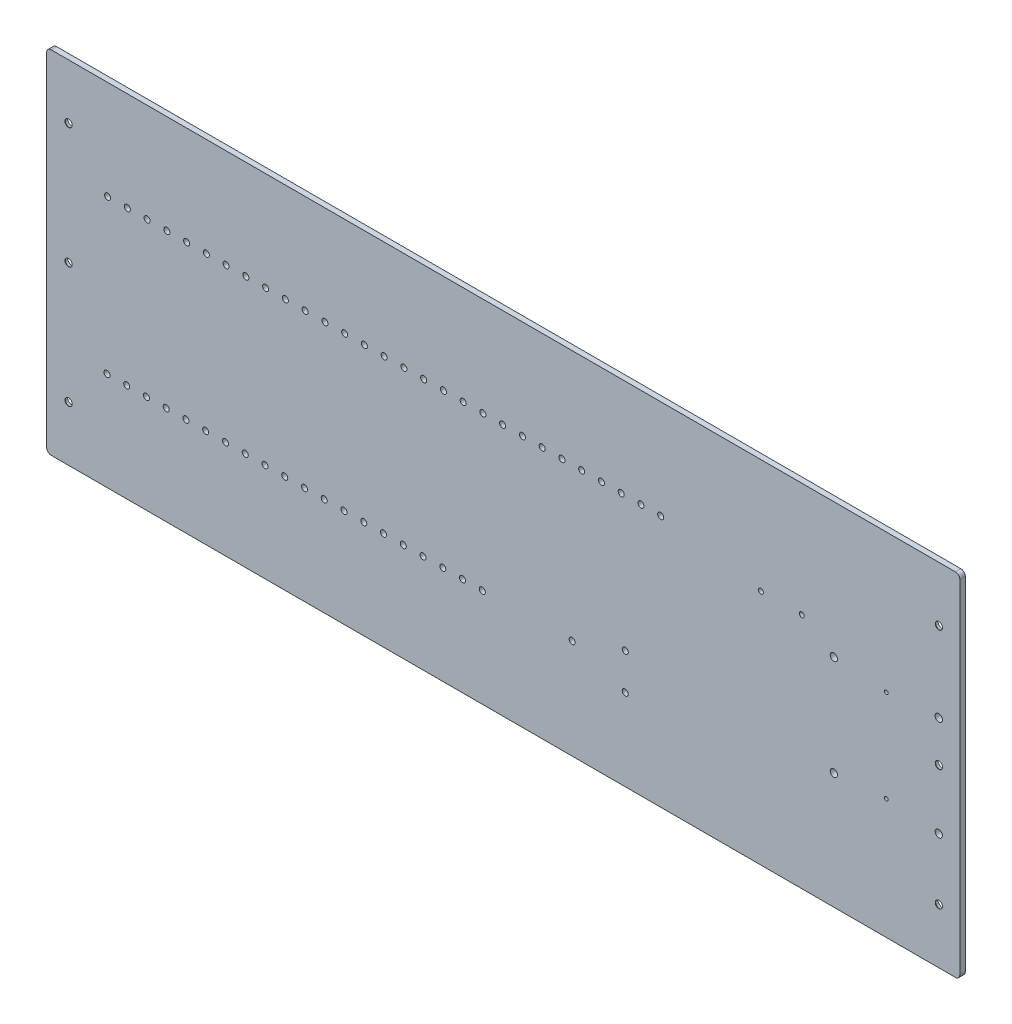
from build123d import *

# Parameters (mm, degrees)
BOSS_EXTRUDE1_DEPTH                           = 5
M6_CLEARANCE_HOLE1_D                          = 6.6
LPATTERN1_COUNT                               = 2
LPATTERN1_PITCH                               = 793
CBORE_FOR_M6_PAN_HEAD_MACHINE_SCREW1_AT_COUNT = 2
CBORE_FOR_M6_PAN_HEAD_MACHINE_SCREW1_AT_PITCH = 110
CBORE_FOR_M6_PAN_HEAD_MACHINE_SCREW1_2_COUNT  = 2
CBORE_FOR_M6_PAN_HEAD_MACHINE_SCREW1_2_PITCH  = 220
CBORE_FOR_M6_PAN_HEAD_MACHINE_SCREW1_3_COUNT  = 2
CBORE_FOR_M6_PAN_HEAD_MACHINE_SCREW1_3_PITCH  = 793
CBORE_FOR_M6_PAN_HEAD_MACHINE_SCREW1_4_COUNT  = 2
CBORE_FOR_M6_PAN_HEAD_MACHINE_SCREW1_4_PITCH  = 800.59290529
CBORE_FOR_M6_PAN_HEAD_MACHINE_SCREW1_5_COUNT  = 2
CBORE_FOR_M6_PAN_HEAD_MACHINE_SCREW1_5_PITCH  = 822.951395892
M5_CLEARANCE_HOLE1_D                          = 5.5
LPATTERN2_COUNT                               = 20
LPATTERN2_PITCH                               = 18
M5_CLEARANCE_HOLE2_D                          = 5.5
LPATTERN3_COUNT                               = 29
LPATTERN3_PITCH                               = 18
M5_CLEARANCE_HOLE3_D                          = 5.5
M3_CLEARANCE_HOLE1_D                          = 3.4
M6_CLEARANCE_HOLE2_D                          = 6.6
M4_CLEARANCE_HOLE1_D                          = 4.5


with BuildPart() as part:
    # Sketch1 → Boss-Extrude1 (new body)
    with BuildSketch(Plane.XY):
        with BuildLine():
            Line((-412, -160), (412, -160))
            ThreePointArc((412, -160), (414.828427125, -158.828427125), (416, -156))
            Line((416, -156), (416, 156))
            ThreePointArc((416, 156), (414.828427125, 158.828427125), (412, 160))
            Line((412, 160), (-412, 160))
            ThreePointArc((-412, 160), (-414.828427125, 158.828427125), (-416, 156))
            Line((-416, 156), (-416, -156))
            ThreePointArc((-416, -156), (-414.828427125, -158.828427125), (-412, -160))
        make_face()
    extrude(amount=BOSS_EXTRUDE1_DEPTH)

    # M6 Clearance Hole1 (through all)
    with Locations(Plane(origin=(0, 0, 0), x_dir=(-1, 0, 0), z_dir=(0, 0, -1))):
        with Locations((-396.934205612, 110), (-396.934205612, 0), (-396.934205612, -110)):
            m6_clearance_hole1 = Hole(M6_CLEARANCE_HOLE1_D / 2)

    # LPattern1: M6 Clearance Hole1 ×2
    with Locations(*[(-i * LPATTERN1_PITCH, 0, 0) for i in range(1, LPATTERN1_COUNT)]):
        add(m6_clearance_hole1, mode=Mode.SUBTRACT)

    # Sketch4 → CBORE for M6 Pan Head Machine Screw1 (revolve, cut)
    with BuildSketch(Plane(origin=(-396.065794388, 110, 0), x_dir=(0, 1, 0), z_dir=(1, 0, 0))):
        Polygon((0, 0), (0, 5), (3.3, 5), (3.3, 4.625), (3.325, 4.6), (6.5, 4.6), (6.5, 0), align=None)
    cbore_for_m6_pan_head_machine_screw1 = revolve(axis=Axis((-396.065794388, 110, -6.35), (0, 0, 1)), mode=Mode.SUBTRACT)

    # CBORE for M6 Pan Head Machine Screw1 at: CBORE for M6 Pan Head Machine Screw1 ×2
    with Locations(*[(0, -i * CBORE_FOR_M6_PAN_HEAD_MACHINE_SCREW1_AT_PITCH, 0) for i in range(1, CBORE_FOR_M6_PAN_HEAD_MACHINE_SCREW1_AT_COUNT)]):
        add(cbore_for_m6_pan_head_machine_screw1, mode=Mode.SUBTRACT)

    # CBORE for M6 Pan Head Machine Screw1 2: CBORE for M6 Pan Head Machine Screw1 ×2
    with Locations(*[(0, -i * CBORE_FOR_M6_PAN_HEAD_MACHINE_SCREW1_2_PITCH, 0) for i in range(1, CBORE_FOR_M6_PAN_HEAD_MACHINE_SCREW1_2_COUNT)]):
        add(cbore_for_m6_pan_head_machine_screw1, mode=Mode.SUBTRACT)

    # CBORE for M6 Pan Head Machine Screw1 3: CBORE for M6 Pan Head Machine Screw1 ×2
    with Locations(*[(i * CBORE_FOR_M6_PAN_HEAD_MACHINE_SCREW1_3_PITCH, 0, 0) for i in range(1, CBORE_FOR_M6_PAN_HEAD_MACHINE_SCREW1_3_COUNT)]):
        add(cbore_for_m6_pan_head_machine_screw1, mode=Mode.SUBTRACT)

    # CBORE for M6 Pan Head Machine Screw1 4: CBORE for M6 Pan Head Machine Screw1 ×2
    with Locations(*[Vector(0.9905158973563135, -0.13739816987288084, 0) * (i * CBORE_FOR_M6_PAN_HEAD_MACHINE_SCREW1_4_PITCH) for i in range(1, CBORE_FOR_M6_PAN_HEAD_MACHINE_SCREW1_4_COUNT)]):
        add(cbore_for_m6_pan_head_machine_screw1, mode=Mode.SUBTRACT)

    # CBORE for M6 Pan Head Machine Screw1 5: CBORE for M6 Pan Head Machine Screw1 ×2
    with Locations(*[Vector(0.9636049029855653, -0.2673304901094885, 0) * (i * CBORE_FOR_M6_PAN_HEAD_MACHINE_SCREW1_5_PITCH) for i in range(1, CBORE_FOR_M6_PAN_HEAD_MACHINE_SCREW1_5_COUNT)]):
        add(cbore_for_m6_pan_head_machine_screw1, mode=Mode.SUBTRACT)

    # M5 Clearance Hole1 (through all)
    with Locations(Plane(origin=(0, 0, 0), x_dir=(-1, 0, 0), z_dir=(0, 0, -1))):
        with Locations((361.09921851, -70.290064712)):
            m5_clearance_hole1 = Hole(M5_CLEARANCE_HOLE1_D / 2)

    # LPattern2: M5 Clearance Hole1 ×20
    with Locations(*[(i * LPATTERN2_PITCH, 0, 0) for i in range(1, LPATTERN2_COUNT)]):
        add(m5_clearance_hole1, mode=Mode.SUBTRACT)

    # M5 Clearance Hole2 (through all)
    with Locations(Plane(origin=(0, 0, 0), x_dir=(-1, 0, 0), z_dir=(0, 0, -1))):
        with Locations((360.518824805, 69.898600249)):
            m5_clearance_hole2 = Hole(M5_CLEARANCE_HOLE2_D / 2)

    # LPattern3: M5 Clearance Hole2 ×29
    with Locations(*[(i * LPATTERN3_PITCH, 0, 0) for i in range(1, LPATTERN3_COUNT)]):
        add(m5_clearance_hole2, mode=Mode.SUBTRACT)

    # M5 Clearance Hole3 (through all)
    with Locations(Plane(origin=(0, 0, 0), x_dir=(-1, 0, 0), z_dir=(0, 0, -1))):
        with Locations((-111.165728877, -85.584868424), (-111.165728877, -52.564868424), (-62.778728877, -69.074868424)):
            Hole(M5_CLEARANCE_HOLE3_D / 2)

    # M3 Clearance Hole1 (through all)
    with Locations(Plane(origin=(0, 0, 0), x_dir=(-1, 0, 0), z_dir=(0, 0, -1))):
        with Locations((-349.021922587, -50.429781186), (-349.021922587, 33.570218814)):
            Hole(M3_CLEARANCE_HOLE1_D / 2)

    # M6 Clearance Hole2 (through all)
    with Locations(Plane(origin=(0, 0, 0), x_dir=(-1, 0, 0), z_dir=(0, 0, -1))):
        with Locations((-301.221922587, -54.129781186), (-301.221922587, 37.370218814), (-396.821922587, 37.270218814), (-396.821922587, -54.129781186)):
            Hole(M6_CLEARANCE_HOLE2_D / 2)

    # M4 Clearance Hole1 (through all)
    with Locations(Plane(origin=(0, 0, 0), x_dir=(-1, 0, 0), z_dir=(0, 0, -1))):
        with Locations((-234.759896157, 56.163908026), (-272.007232298, 56.163908026)):
            Hole(M4_CLEARANCE_HOLE1_D / 2)


solid = part.part
